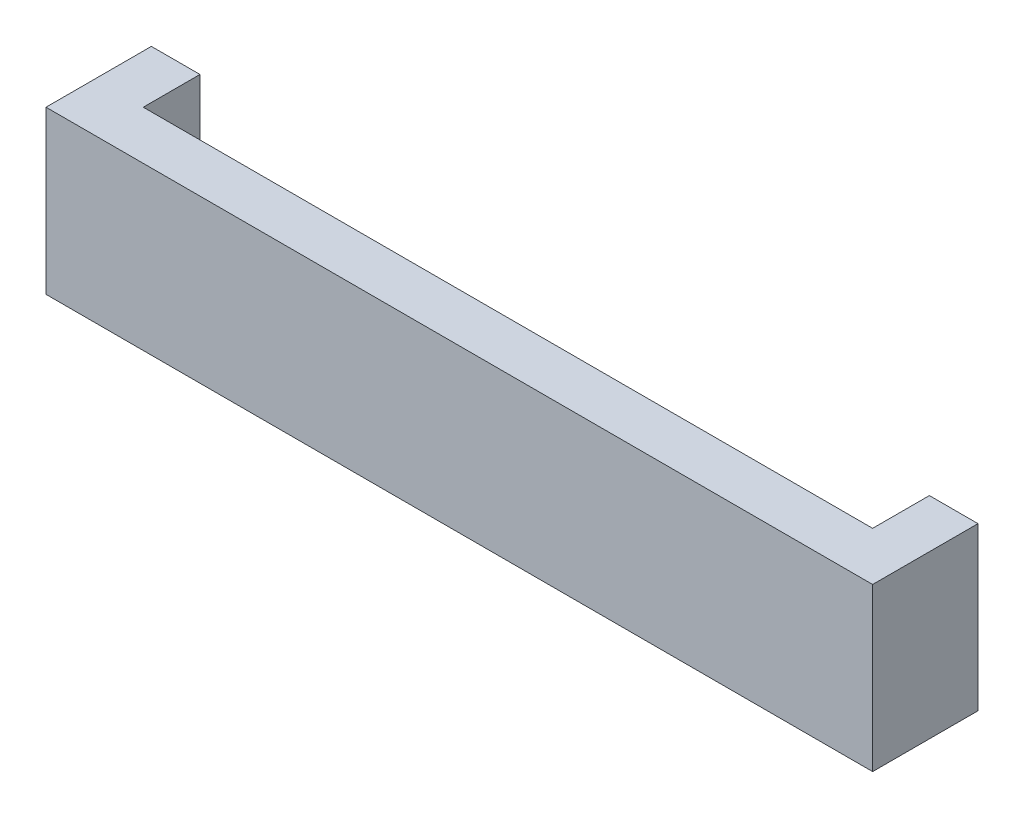
from build123d import *

# Parameters (mm, degrees)
SKETCH1_W           = 51
SKETCH1_H           = 10
BOSS_EXTRUDE1_DEPTH = 6.5
SKETCH2_W           = 45
SKETCH2_H           = 3.5
CUT_EXTRUDE1_DEPTH  = 10


with BuildPart() as part:
    # Sketch1 → Boss-Extrude1 (new body)
    with BuildSketch(Plane.XY):
        Rectangle(SKETCH1_W, SKETCH1_H)
    extrude(amount=BOSS_EXTRUDE1_DEPTH)

    # Sketch2 → Cut-Extrude1 (cut)
    with BuildSketch(Plane.XZ.offset(5)):
        with Locations((0, 1.75)):
            Rectangle(SKETCH2_W, SKETCH2_H)
    extrude(amount=-CUT_EXTRUDE1_DEPTH, mode=Mode.SUBTRACT)


solid = part.part
